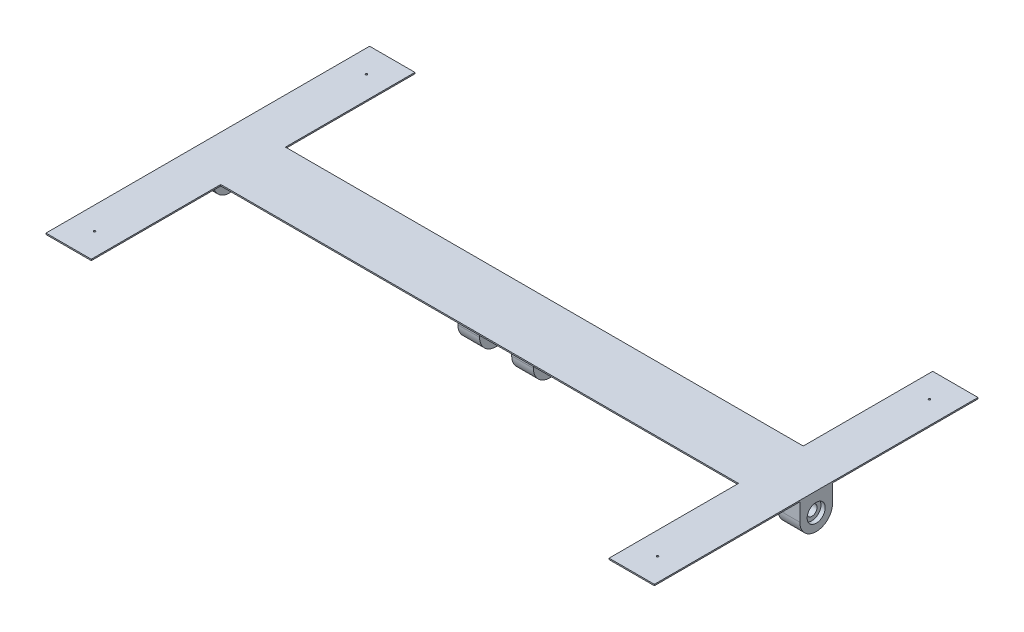
from build123d import *

# Parameters (mm, degrees)
BOSS_EXTRUDE1_DEPTH     = 10
SKETCH3_R               = 126.5
SKETCH3_W               = 253
SKETCH3_H               = 136.5
BOSS_EXTRUDE2_DEPTH     = 168
SKETCH6_R               = 70
CUT_EXTRUDE1_DEPTH      = 33
SKETCH7_R               = 40
CUT_EXTRUDE2_DEPTH      = 5212.371604482
CUT_EXTRUDE4_START      = -33
SKETCH9_R               = 70
CUT_EXTRUDE4_DEPTH      = 33
SKETCH8_R               = 7
CUT_EXTRUDE3_DEPTH      = 5331.528022626
LPATTERN1_COUNT         = 2
LPATTERN1_PITCH         = 2058
MIRROR4_COPY_1_SKETCH_R = 126.5
MIRROR4_COPY_1_SKETCH_W = 253
MIRROR4_COPY_1_SKETCH_H = 136.5
MIRROR4_COPY_1_DEPTH    = 168
MIRROR4_COPY_2_SKETCH_R = 70
MIRROR4_COPY_2_DEPTH    = 33
MIRROR4_COPY_3_SKETCH_R = 40
MIRROR4_COPY_3_DEPTH    = 5212.371604482
MIRROR4_START           = -33
MIRROR4_COPY_4_SKETCH_R = 70
MIRROR4_COPY_4_DEPTH    = 33


with BuildPart() as part:
    # Sketch1 → Boss-Extrude1 (new body)
    with BuildSketch(Plane(origin=(0, 0, 0), x_dir=(1, 0, 0), z_dir=(0, 1, 0))):
        Polygon((0, 2500), (0, 1250), (4700, 1250), (4700, 2500), (4350, 2500), (4350, 1500), (350, 1500), (350, 2500), align=None)
        Polygon((4700, 1250), (0, 1250), (0, 0), (350, 0), (350, 1000), (4350, 1000), (4350, 0), (4700, 0), align=None)
    extrude(amount=BOSS_EXTRUDE1_DEPTH)

    # Sketch3 → Boss-Extrude2 (add)
    with BuildSketch(Plane(origin=(0, 0, 0), x_dir=(0, 0, -1), z_dir=(1, 0, 0))):
        with Locations((1250, -136.5)):
            Circle(SKETCH3_R)
        with Locations((1250, -68.25)):
            Rectangle(SKETCH3_W, SKETCH3_H)
    boss_extrude2 = extrude(amount=BOSS_EXTRUDE2_DEPTH)

    # Mirror1: Boss-Extrude2 across plane
    add(boss_extrude2.mirror(Plane.ZY.offset(-2350)))

    # Sketch6 → Cut-Extrude1 (cut)
    with BuildSketch(Plane(origin=(168, 0, 0), x_dir=(0, 0, -1), z_dir=(1, 0, 0))):
        with Locations((1250, -136.5)):
            Circle(SKETCH6_R)
    cut_extrude1 = extrude(amount=-CUT_EXTRUDE1_DEPTH, mode=Mode.SUBTRACT)

    # Sketch7 → Cut-Extrude2 (cut, through all)
    with BuildSketch(Plane(origin=(135, 0, 0), x_dir=(0, 0, -1), z_dir=(1, 0, 0))):
        with Locations((1250, -136.5)):
            Circle(SKETCH7_R)
    cut_extrude2 = extrude(amount=-CUT_EXTRUDE2_DEPTH, mode=Mode.SUBTRACT)

    # Sketch9 → Cut-Extrude4 (cut)
    with BuildSketch(Plane.ZY.offset(CUT_EXTRUDE4_START)):
        with Locations(Location((-1250, -136.5, 0), (0, 0, 180))):
            Circle(SKETCH9_R)
    cut_extrude4 = extrude(amount=CUT_EXTRUDE4_DEPTH, mode=Mode.SUBTRACT)

    # Mirror2: Cut-Extrude1, Cut-Extrude2, Cut-Extrude4 across plane
    add(cut_extrude1.mirror(Plane.ZY.offset(-2350)), mode=Mode.SUBTRACT)
    add(cut_extrude2.mirror(Plane.ZY.offset(-2350)), mode=Mode.SUBTRACT)
    add(cut_extrude4.mirror(Plane.ZY.offset(-2350)), mode=Mode.SUBTRACT)

    # Sketch8 → Cut-Extrude3 (cut, through all)
    with BuildSketch(Plane(origin=(0, 10, 0), x_dir=(1, 0, 0), z_dir=(0, 1, 0))):
        with Locations(Location((4525, 2300, 0), (0, 0, 270))):
            Circle(SKETCH8_R)
        with Locations(Location((4525, 200, 0), (0, 0, 270))):
            Circle(SKETCH8_R)
    cut_extrude3 = extrude(amount=-CUT_EXTRUDE3_DEPTH, mode=Mode.SUBTRACT)

    # Mirror3: Cut-Extrude3 across plane
    add(cut_extrude3.mirror(Plane.ZY.offset(-2350)), mode=Mode.SUBTRACT)

    # LPattern1: Boss-Extrude2, Cut-Extrude1, Cut-Extrude2, Cut-Extrude4 ×2
    with Locations(*[(i * LPATTERN1_PITCH, 0, 0) for i in range(1, LPATTERN1_COUNT)]):
        add(boss_extrude2)
        add(cut_extrude1, mode=Mode.SUBTRACT)
        add(cut_extrude2, mode=Mode.SUBTRACT)
        add(cut_extrude4, mode=Mode.SUBTRACT)

    # Mirror4: Boss-Extrude2, Cut-Extrude1, Cut-Extrude2, Cut-Extrude4 across plane
    add(boss_extrude2.mirror(Plane.ZY.offset(-2350)))
    add(cut_extrude1.mirror(Plane.ZY.offset(-2350)), mode=Mode.SUBTRACT)
    add(cut_extrude2.mirror(Plane.ZY.offset(-2350)), mode=Mode.SUBTRACT)
    add(cut_extrude4.mirror(Plane.ZY.offset(-2350)), mode=Mode.SUBTRACT)

    # Mirror4 copy 1 sketch → Mirror4 copy 1 (add)
    with BuildSketch(Plane(origin=(2642, 0, 0), x_dir=(0, 0, -1), z_dir=(-1, 0, 0))):
        with Locations((1250, 136.5)):
            Circle(MIRROR4_COPY_1_SKETCH_R)
        with Locations((1250, 68.25)):
            Rectangle(MIRROR4_COPY_1_SKETCH_W, MIRROR4_COPY_1_SKETCH_H)
    extrude(amount=MIRROR4_COPY_1_DEPTH)

    # Mirror4 copy 2 sketch → Mirror4 copy 2 (cut)
    with BuildSketch(Plane(origin=(2474, 0, 0), x_dir=(0, 0, -1), z_dir=(-1, 0, 0))):
        with Locations((1250, 136.5)):
            Circle(MIRROR4_COPY_2_SKETCH_R)
    extrude(amount=-MIRROR4_COPY_2_DEPTH, mode=Mode.SUBTRACT)

    # Mirror4 copy 3 sketch → Mirror4 copy 3 (cut, through all)
    with BuildSketch(Plane(origin=(2507, 0, 0), x_dir=(0, 0, -1), z_dir=(-1, 0, 0))):
        with Locations((1250, 136.5)):
            Circle(MIRROR4_COPY_3_SKETCH_R)
    extrude(amount=-MIRROR4_COPY_3_DEPTH, mode=Mode.SUBTRACT)

    # Mirror4 copy 4 sketch → Mirror4 copy 4 (cut)
    with BuildSketch(Plane(origin=(2642, 0, 0), x_dir=(0, 0, 1), z_dir=(1, 0, 0)).offset(MIRROR4_START)):
        with Locations((-1250, 136.5)):
            Circle(MIRROR4_COPY_4_SKETCH_R)
    extrude(amount=MIRROR4_COPY_4_DEPTH, mode=Mode.SUBTRACT)


solid = part.part
